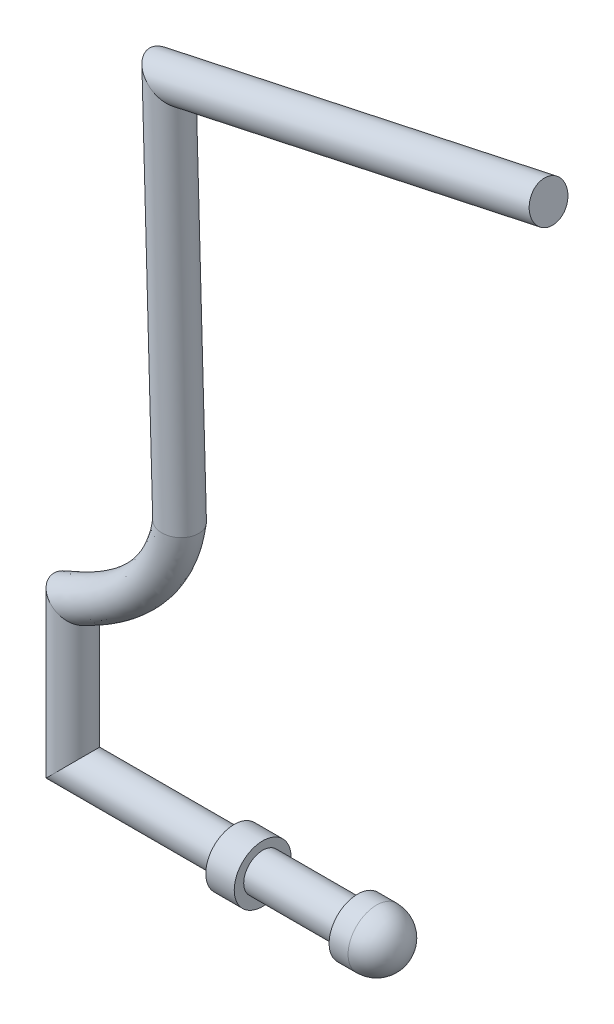
from build123d import *

# Parameters (mm, degrees)
SWEEP2_PROFILE_R    = 2
SKETCH33_R          = 3
BOSS_EXTRUDE1_DEPTH = 5
FILLET1_R           = 3
BOSS_EXTRUDE2_START = 10
SKETCH35_R          = 3
BOSS_EXTRUDE2_DEPTH = 3


with BuildPart() as part:
    # Sweep2: sweep along a path in Sketch23
    with BuildLine() as sweep2_path:  # in the path sketch's own coordinates; laid on its plane below (add() does not lay a ready-made edge on the line's plane)
        Line((23.070153722, 32.663094734), (-16.929846278, 24.054675346))
        Line((-16.929846278, 24.054675346), (-15.815815534, -15.945324654))
        add(Edge.make_bspline(
            [(-15.815815534, -15.945324654), (-17.108876688, -24.239763011), (-27.057398499, -28.604764931)],
            knots=[0, 0, 0, 1, 1, 1], degree=2))
        Line((-27.057398499, -28.604764931), (-27.057398499, -43.604764931))
        Line((-27.057398499, -43.604764931), (2.942601501, -43.604764931))
    # Sweep2 profile (on start of the path) → Sweep2 (sweep)
    with BuildSketch(Plane(origin=(23.070153722, 32.663094734, 0), x_dir=(0.21039338703389382, -0.977616807697375, 0), z_dir=(-0.977616807697375, -0.21039338703389382, 0))):
        Circle(SWEEP2_PROFILE_R)
    sweep(path=Plane.XY * sweep2_path.line, transition=Transition.RIGHT)

    # Sketch33 → Boss-Extrude1 (add)
    with BuildSketch(Plane(origin=(2.942601501, 0, 0), x_dir=(0, 0, -1), z_dir=(1, 0, 0))):
        with Locations((0, -43.604764931)):
            Circle(SKETCH33_R)
    extrude(amount=BOSS_EXTRUDE1_DEPTH)

    # Fillet1
    fillet1_edges = [part.edges().sort_by_distance(p)[0] for p in [
        (7.942601501, -43.604764931, 3),
    ]]
    fillet(fillet1_edges, radius=FILLET1_R)

    # Sketch35 → Boss-Extrude2 (add)
    with BuildSketch(Plane.ZY.offset(-2.942601501).offset(BOSS_EXTRUDE2_START)):
        with Locations((0, -43.741255524)):
            Circle(SKETCH35_R)
    extrude(amount=BOSS_EXTRUDE2_DEPTH)


solid = part.part
